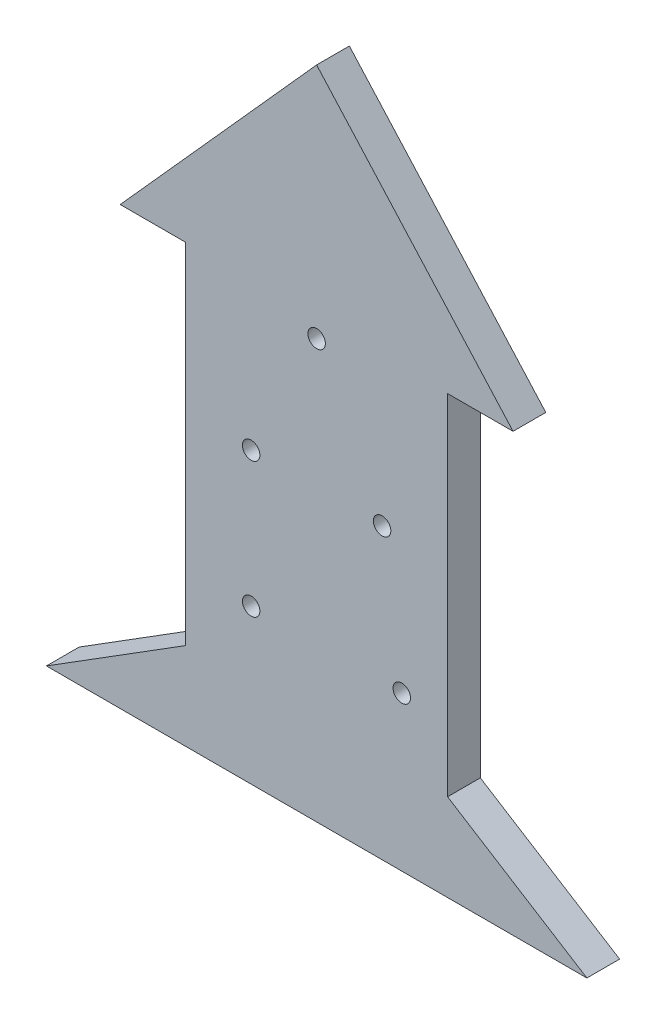
from build123d import *

# Parameters (mm, degrees)
BOSS_EXTRU_1_DEPTH      = 15
ESQUISSE2_R             = 4
ENL_V_MAT_EXTRU_2_DEPTH = 60
ESQUISSE4_R             = 4
ENL_V_MAT_EXTRU_3_DEPTH = 60


with BuildPart() as part:
    # Esquisse1 → Boss.-Extru.1 (new body)
    with BuildSketch(Plane.XY):
        Polygon((60, -80.714285714), (123.820965425, -120.714285714), (-123.82, -120.714285714), (-60, -80.714285714), (-60, 79.285714286), (-90, 79.285714286), (0, 179.686053035), (90, 79.285714286), (60, 79.285714286), align=None)
    extrude(amount=BOSS_EXTRU_1_DEPTH)

    # Esquisse2 → Enlèv. mat.-Extru.2 (cut)
    with BuildSketch(Plane.XY.offset(15)):
        with Locations((0, 71.092567552)):
            Circle(ESQUISSE2_R)
    extrude(amount=-ENL_V_MAT_EXTRU_2_DEPTH, mode=Mode.SUBTRACT)

    # Esquisse4 → Enlèv. mat.-Extru.3 (cut)
    with BuildSketch(Plane.XY.offset(15)):
        with Locations((30, 11.786912572)):
            Circle(ESQUISSE4_R)
        with Locations((39.013840353, -50.053697219)):
            Circle(ESQUISSE4_R)
        with Locations((-30, 11.786912572)):
            Circle(ESQUISSE4_R)
        with Locations((-30, -50.053697219)):
            Circle(ESQUISSE4_R)
    extrude(amount=-ENL_V_MAT_EXTRU_3_DEPTH, mode=Mode.SUBTRACT)


solid = part.part
